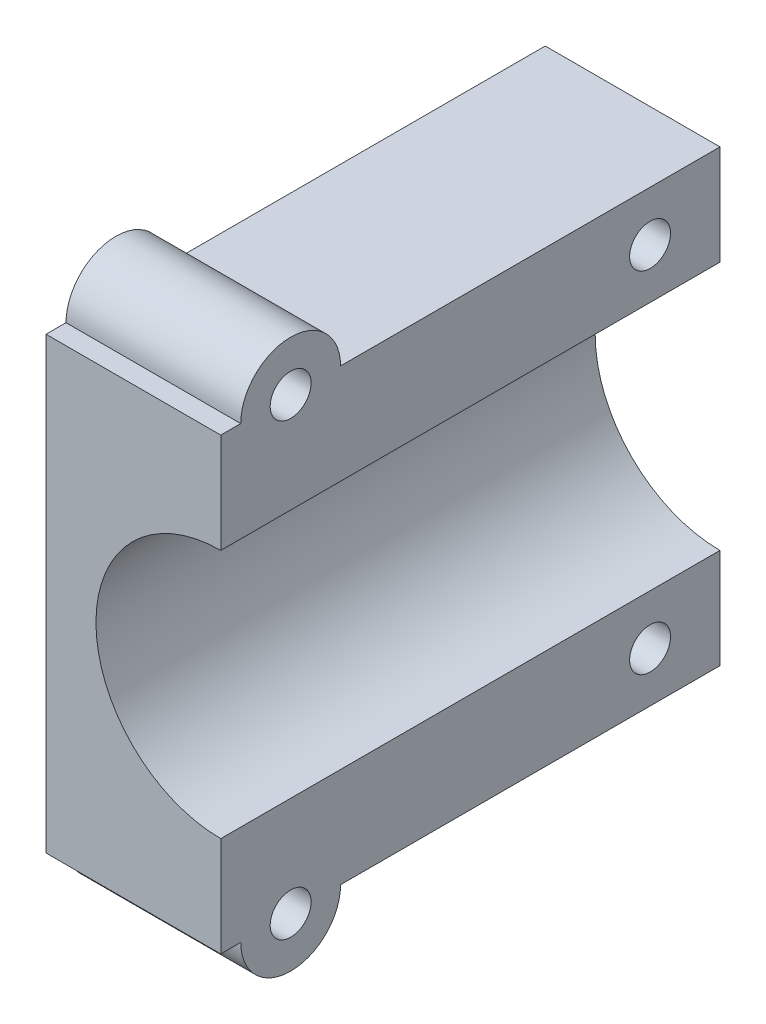
from build123d import *
from build123d.topology import SkipClean

# Parameters (mm, degrees)
BOSS_EXTRUDE1_DEPTH             = 25
BOSS_EXTRUDE2_REACH             = 65.362
BOSS_EXTRUDE2_DIRECTION_2_DEPTH = 30
SKETCH9_R                       = 2.05
CUT_EXTRUDE3_DEPTH              = 35
BOSS_EXTRUDE5_REACH             = 63.601
SKETCH13_R                      = 1.55
CUT_EXTRUDE4_DEPTH              = 88.693844753
SKETCH16_W                      = 63
SKETCH16_H                      = 45
CUT_EXTRUDE5_DEPTH              = 65.196143
BOSS_EXTRUDE6_DEPTH             = 17.5
SKETCH18_R                      = 2.05
CUT_EXTRUDE6_DEPTH              = 17.5


with BuildPart() as part:
    # Sketch1 → Boss-Extrude1 (new, symmetric)
    with BuildSketch(Plane.XY):
        with BuildLine():
            Line((-17.5, 22.5), (-17.5, 0))
            Line((-17.5, 0), (17.5, 0))
            Line((17.5, 0), (17.5, 22.5))
            Line((17.5, 22.5), (12.5, 22.5))
            ThreePointArc((12.5, 22.5), (0, 10), (-12.5, 22.5))
            Line((-12.5, 22.5), (-17.5, 22.5))
        make_face()
    boss_extrude1 = extrude(amount=BOSS_EXTRUDE1_DEPTH, both=True)

    # Boss-Extrude2: up to this face of the body (flat: up to its plane)
    boss_extrude2_end = Plane(part.part.faces().sort_by_distance((17.5, 11.25, 0))[0])
    # Sketch5 → Boss-Extrude2 (add, up to the picked face)
    with BuildSketch(Plane(origin=(26.115381057, 0, 15.077722283), x_dir=(0.500000000000001, 0, -0.8660254037844382), z_dir=(0.8660254037844382, 0, 0.500000000000001)), mode=Mode.PRIVATE) as boss_extrude2_sk1:
        with BuildLine():
            Line((-8.7, 22.5), (-3.75, 22.5))
            ThreePointArc((-3.75, 22.5), (8.75, 10), (21.25, 22.5))
            Line((21.25, 22.5), (26.2, 22.5))
            ThreePointArc((26.2, 22.5), (8.75, 5.05), (-8.7, 22.5))
        make_face()
    boss_extrude2_tool1 = split(extrude(boss_extrude2_sk1.sketch, amount=-BOSS_EXTRUDE2_REACH, mode=Mode.PRIVATE), bisect_by=boss_extrude2_end, keep=Keep.BOTH, mode=Mode.PRIVATE)
    boss_extrude2 = boss_extrude2_tool1.solids().sort_by(Axis((23.002881, 22.109806, 20.46873), (-0.8660254037844382, 0, -0.500000000000001)))[0]
    add(boss_extrude2)

    # Sketch5 → Boss-Extrude2 direction 2 (add)
    with BuildSketch(Plane(origin=(26.115381057, 0, 15.077722283), x_dir=(0.500000000000001, 0, -0.8660254037844382), z_dir=(0.8660254037844382, 0, 0.500000000000001))):
        with BuildLine():
            Line((-8.7, 22.5), (-3.75, 22.5))
            ThreePointArc((-3.75, 22.5), (8.75, 10), (21.25, 22.5))
            Line((21.25, 22.5), (26.2, 22.5))
            ThreePointArc((26.2, 22.5), (8.75, 5.05), (-8.7, 22.5))
        make_face()
    boss_extrude2_direction_2 = extrude(amount=BOSS_EXTRUDE2_DIRECTION_2_DEPTH)

    # Sketch9 → Cut-Extrude3 (cut)
    with BuildSketch(Plane.ZY.offset(17.5)):
        with Locations((-18, 5)):
            Circle(SKETCH9_R)
    cut_extrude3 = extrude(amount=-CUT_EXTRUDE3_DEPTH, mode=Mode.SUBTRACT)

    # Boss-Extrude5: up to this face of the body (flat: up to its plane)
    boss_extrude5_end = Plane(part.part.faces().sort_by_distance((17.5, 17.19483523, 0))[0])
    # Sketch12 → Boss-Extrude5 (add, up to the picked face)
    with BuildSketch(Plane(origin=(21.973076211, 0, 12.686161466), x_dir=(0.4999999999999999, 0, -0.8660254037844388), z_dir=(0.8660254037844388, 0, 0.4999999999999999)), mode=Mode.PRIVATE) as boss_extrude5_sk1:
        with BuildLine():
            Line((-3.75, 22.5), (21.25, 22.5))
            ThreePointArc((21.25, 22.5), (8.75, 10), (-3.75, 22.5))
        make_face()
    boss_extrude5_tool1 = split(extrude(boss_extrude5_sk1.sketch, amount=-BOSS_EXTRUDE5_REACH, mode=Mode.PRIVATE), bisect_by=boss_extrude5_end, keep=Keep.BOTH, mode=Mode.PRIVATE)
    boss_extrude5 = boss_extrude5_tool1.solids().sort_by(Axis((26.348076, 17.194835, 5.108439), (-0.8660254037844388, 0, -0.4999999999999999)))[0]
    add(boss_extrude5)

    # Mirror1: Boss-Extrude1, Boss-Extrude2, Boss-Extrude2 direction 2, Cut-Extrude3, Boss-Extrude5 across plane
    with SkipClean():  # the faces are left unmerged after this step: merging them gives an invalid solid
        add(boss_extrude1.mirror(Plane(origin=(17.5, 22.5, 25), x_dir=(0, 0, 1), z_dir=(0, -1, 0))))
        add(boss_extrude2.mirror(Plane(origin=(17.5, 22.5, 25), x_dir=(0, 0, 1), z_dir=(0, -1, 0))))
        add(boss_extrude2_direction_2.mirror(Plane(origin=(17.5, 22.5, 25), x_dir=(0, 0, 1), z_dir=(0, -1, 0))))
        add(cut_extrude3.mirror(Plane(origin=(17.5, 22.5, 25), x_dir=(0, 0, 1), z_dir=(0, -1, 0))), mode=Mode.SUBTRACT)
        add(boss_extrude5.mirror(Plane(origin=(17.5, 22.5, 25), x_dir=(0, 0, 1), z_dir=(0, -1, 0))))

    # Sketch13 → Cut-Extrude4 (cut, through all)
    with SkipClean():  # the faces are left unmerged after this step: merging them gives an invalid solid
        with BuildSketch(Plane(origin=(0, 0, 0), x_dir=(1, 0, 0), z_dir=(0, 1, 0))):
            with Locations(Location((43.480762114, -15, 0), (0, 0, 90))):
                Circle(SKETCH13_R)
        extrude(amount=CUT_EXTRUDE4_DEPTH, mode=Mode.SUBTRACT)

    # Sketch16 → Cut-Extrude5 (cut)
    with BuildSketch(Plane(origin=(0, 0, 0), x_dir=(0, 0, -1), z_dir=(1, 0, 0))):
        with Locations((-6.5, 22.5)):
            Rectangle(SKETCH16_W, SKETCH16_H)
    extrude(amount=CUT_EXTRUDE5_DEPTH, mode=Mode.SUBTRACT)

    # Sketch17 → Boss-Extrude6 (add)
    with BuildSketch(Plane.ZY.offset(17.5)):
        with BuildLine():
            Line((13, 0), (23, 0))
            ThreePointArc((23, 0), (18, -5), (13, 0))
        make_face()
    boss_extrude6 = extrude(amount=-BOSS_EXTRUDE6_DEPTH)

    # Sketch18 → Cut-Extrude6 (cut)
    with BuildSketch(Plane.ZY.offset(17.5)):
        with Locations(Location((18, 0, 0), (0, 0, 270))):
            Circle(SKETCH18_R)
    cut_extrude6 = extrude(amount=-CUT_EXTRUDE6_DEPTH, mode=Mode.SUBTRACT)

    # Mirror2: Boss-Extrude6, Cut-Extrude6 across plane
    add(boss_extrude6.mirror(Plane.ZX.offset(22.5)))
    add(cut_extrude6.mirror(Plane.ZX.offset(22.5)), mode=Mode.SUBTRACT)


solid = part.part
